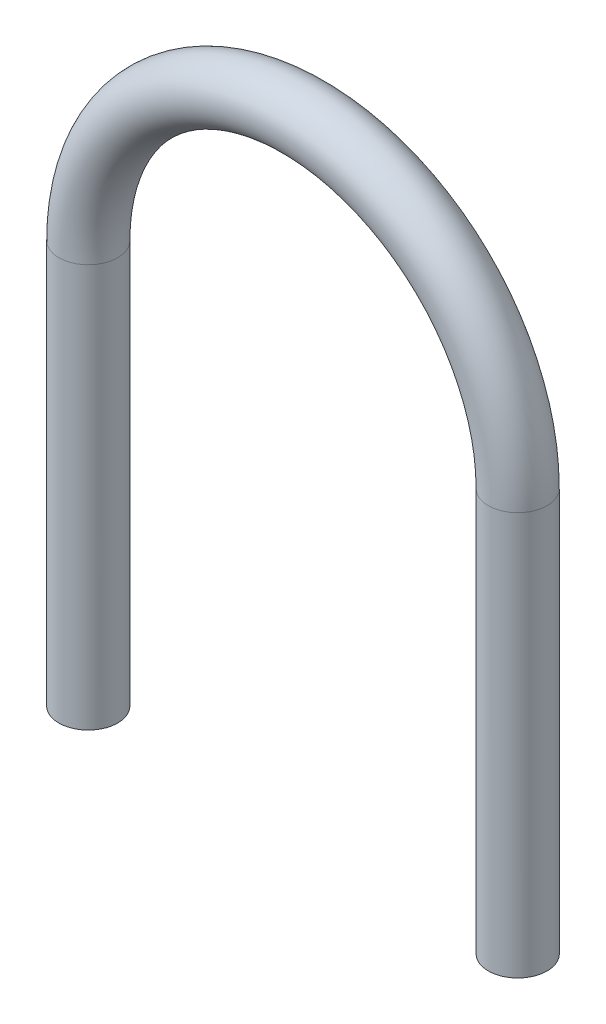
from build123d import *

# Parameters (mm, degrees)
CROQUIS1_R = 3.969


with BuildPart() as part:
    # Barrer1: sweep along a path in Croquis2
    with BuildLine(Plane.XY) as barrer1_path:
        Line((-28.969, 0), (-28.969, 54.369))
        ThreePointArc((-28.969, 54.369), (0, 83.338), (28.969, 54.369))
        Line((28.969, 54.369), (28.969, 0))
    # Croquis1 → Barrer1 (sweep)
    with BuildSketch(Plane(origin=(0, 0, 0), x_dir=(1, 0, 0), z_dir=(0, 1, 0))):
        with Locations((28.969, 0)):
            Circle(CROQUIS1_R)
    sweep(path=barrer1_path.line)


solid = part.part
